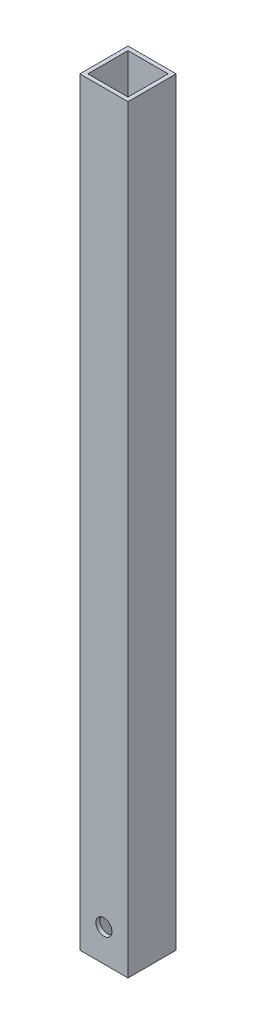
from build123d import *

# Parameters (mm, degrees)
SKETCH1_W           = 19.05
SKETCH1_H           = 19.05
SKETCH1_W_2         = 15.875
SKETCH1_H_2         = 15.875
BOSS_EXTRUDE1_DEPTH = 300
SKETCH2_R           = 3.175
CUT_EXTRUDE1_DEPTH  = 301.75509659


with BuildPart() as part:
    # Sketch1 → Boss-Extrude1 (new body)
    with BuildSketch(Plane(origin=(0, 0, 0), x_dir=(1, 0, 0), z_dir=(0, 1, 0))):
        Rectangle(SKETCH1_W, SKETCH1_H)
        Rectangle(SKETCH1_W_2, SKETCH1_H_2, mode=Mode.SUBTRACT)
    extrude(amount=BOSS_EXTRUDE1_DEPTH)

    # Sketch2 → Cut-Extrude1 (cut, through all)
    with BuildSketch(Plane.XY.offset(9.525)):
        with Locations((0, 12.7)):
            Circle(SKETCH2_R)
    extrude(amount=-CUT_EXTRUDE1_DEPTH, mode=Mode.SUBTRACT)


solid = part.part
